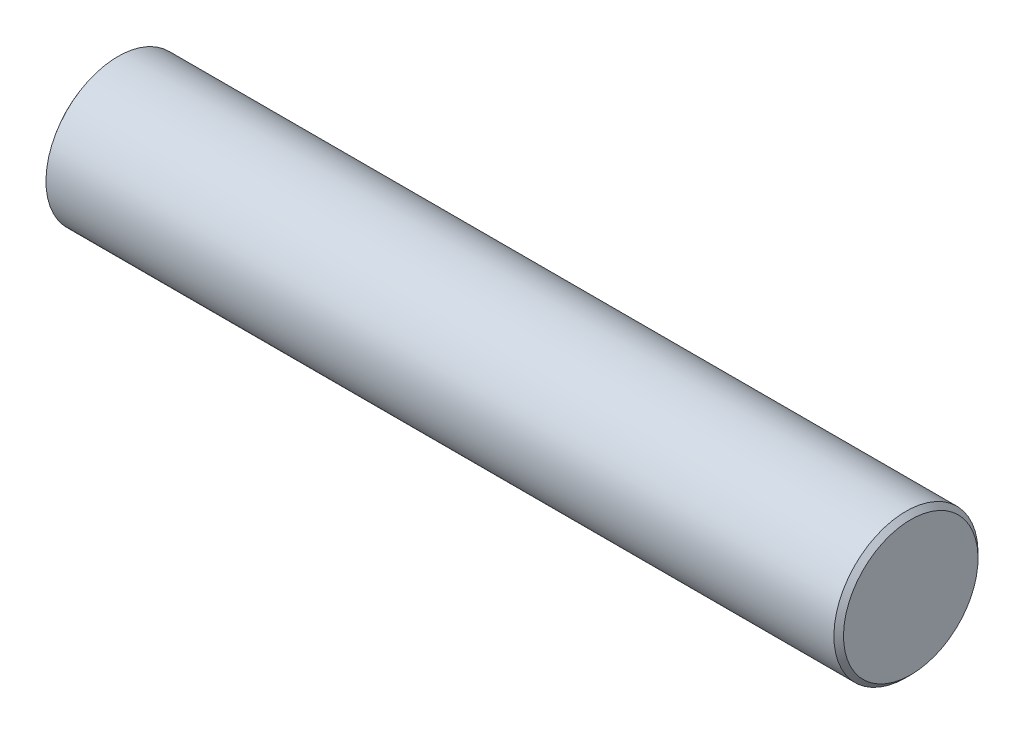
from build123d import *


with BuildPart() as part:
    # Skizze12 → Rotation1 (revolve)
    with BuildSketch(Plane.XY, mode=Mode.PRIVATE) as rotation1_sk:
        Polygon((-83, 0), (-83, 13.621449538), (-82, 15), (82, 15), (83, 14), (83, 0), align=None)
    revolve(rotation1_sk.sketch.rotate(Axis((-83, 0, 0), (1, 0, 0)), 180), axis=Axis((-83, 0, 0), (1, 0, 0)))


solid = part.part
